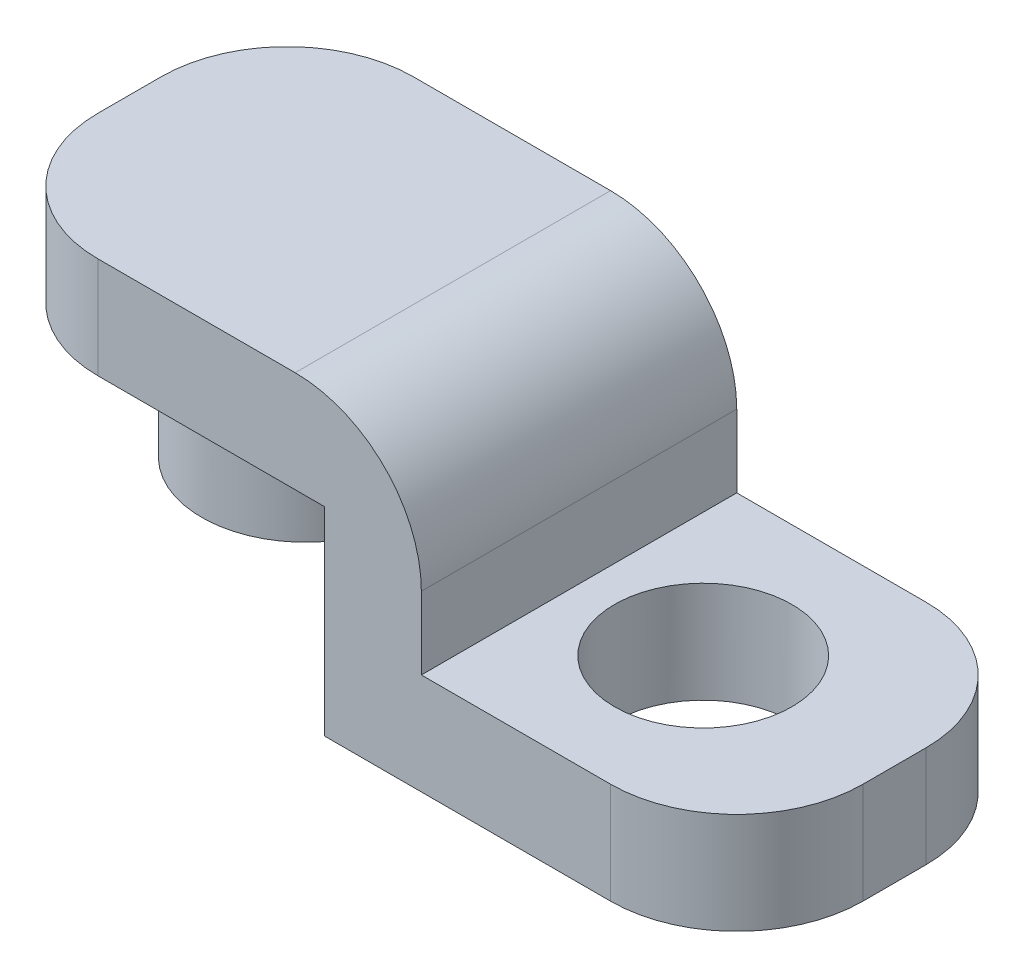
from build123d import *

# Parameters (mm, degrees)
BOSS_EXTRUDE1_DEPTH = 6.35
FILLET1_R           = 2.54
CUT_EXTRUDE1_REACH  = 16.027
SKETCH2_R           = 1.7859375
SKETCH4_W           = 6.35
SKETCH4_H           = 2.04
BOSS_EXTRUDE3_DEPTH = 3.55
SKETCH6_R           = 2.1
BOSS_EXTRUDE5_DEPTH = 2.5
FILLET3_R           = 2.54


with BuildPart() as part:
    # Sketch1 → Boss-Extrude1 (new body)
    with BuildSketch(Plane.XY):
        Polygon((0, 6.04), (5.5, 6.04), (5.5, 2.04), (11.85, 2.04), (11.85, 0), (3.55, 0), (3.55, 4), (0, 4), align=None)
    extrude(amount=BOSS_EXTRUDE1_DEPTH)

    # Fillet1
    fillet1_edges = [part.edges().sort_by_distance(p)[0] for p in [
        (5.5, 6.04, 3.175),
        (11.85, 1.02, 6.35),
        (11.85, 1.02, 0),
    ]]
    fillet(fillet1_edges, radius=FILLET1_R)

    # Sketch2 → Cut-Extrude1 (cut, up to next)
    with BuildSketch(Plane(origin=(0, 2.04, 0), x_dir=(1, 0, 0), z_dir=(0, 1, 0)), mode=Mode.PRIVATE) as cut_extrude1_sk1:
        with Locations(Location((8, -3.175, 0), (0, 0, 270))):
            Circle(SKETCH2_R)
    cut_extrude1_tool1 = extrude(cut_extrude1_sk1.sketch, amount=-CUT_EXTRUDE1_REACH, mode=Mode.PRIVATE) & part.part
    add(cut_extrude1_tool1.solids().sort_by_distance((8, 2.04, 3.175))[0], mode=Mode.SUBTRACT)

    # Sketch4 → Boss-Extrude3 (add)
    with BuildSketch(Plane.ZY):
        with Locations((3.175, 5.02)):
            Rectangle(SKETCH4_W, SKETCH4_H)
    extrude(amount=BOSS_EXTRUDE3_DEPTH)

    # Sketch6 → Boss-Extrude5 (add)
    with BuildSketch(Plane.XZ.offset(-4)):
        with Locations(Location((0, 3.175, 0), (0, 0, 180))):
            Circle(SKETCH6_R)
    extrude(amount=BOSS_EXTRUDE5_DEPTH)

    # Fillet3
    fillet3_edges = [part.edges().sort_by_distance(p)[0] for p in [
        (-3.55, 5.02, 6.35),
        (-3.55, 5.02, 0),
    ]]
    fillet(fillet3_edges, radius=FILLET3_R)


solid = part.part
